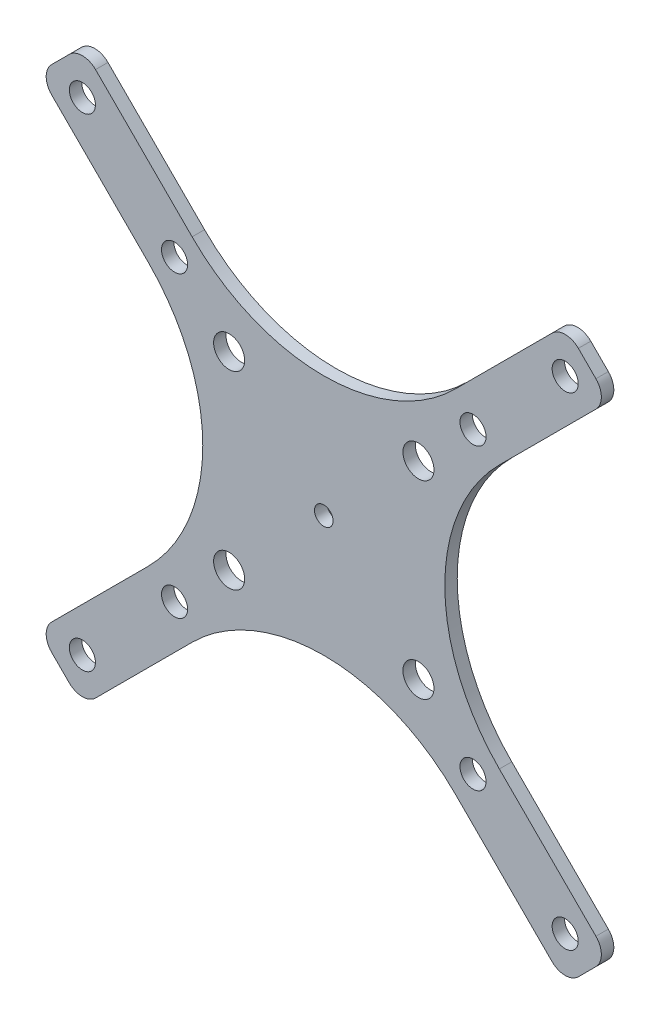
from build123d import *

# Parameters (mm, degrees)
CROQUIS1_R              = 2.5
CROQUIS1_R_2            = 2.1
CROQUIS1_R_3            = 1.5
SALIENTE_EXTRUIR1_DEPTH = 2
REDONDEO3_R             = 3


with BuildPart() as part:
    # Croquis1 → Saliente-Extruir1 (new body)
    with BuildSketch(Plane.XY):
        with BuildLine():
            Line((-31.096194078, 38.16726189), (-21.213203436, 28.284271247))
            ThreePointArc((-21.213203436, 28.284271247), (0, 19.497474683), (21.213203436, 28.284271247))
            Line((21.213203436, 28.284271247), (31.096194078, 38.16726189))
            Line((31.096194078, 38.16726189), (38.890872965, 45.961940777))
            Line((38.890872965, 45.961940777), (42.426406871, 42.426406871))
            Line((42.426406871, 42.426406871), (45.961940777, 38.890872965))
            Line((45.961940777, 38.890872965), (38.16726189, 31.096194078))
            Line((38.16726189, 31.096194078), (28.284271247, 21.213203436))
            ThreePointArc((28.284271247, 21.213203436), (19.497474683, 0), (28.284271247, -21.213203436))
            Line((28.284271247, -21.213203436), (38.16726189, -31.096194078))
            Line((38.16726189, -31.096194078), (45.961940777, -38.890872965))
            Line((45.961940777, -38.890872965), (42.426406871, -42.426406871))
            Line((42.426406871, -42.426406871), (38.890872965, -45.961940777))
            Line((38.890872965, -45.961940777), (31.096194078, -38.16726189))
            Line((31.096194078, -38.16726189), (21.213203436, -28.284271247))
            ThreePointArc((21.213203436, -28.284271247), (0, -19.497474683), (-21.213203436, -28.284271247))
            Line((-21.213203436, -28.284271247), (-31.096194078, -38.16726189))
            Line((-31.096194078, -38.16726189), (-38.890872965, -45.961940777))
            Line((-38.890872965, -45.961940777), (-42.426406871, -42.426406871))
            Line((-42.426406871, -42.426406871), (-45.961940777, -38.890872965))
            Line((-45.961940777, -38.890872965), (-38.16726189, -31.096194078))
            Line((-38.16726189, -31.096194078), (-28.284271247, -21.213203436))
            ThreePointArc((-28.284271247, -21.213203436), (-19.497474683, 0), (-28.284271247, 21.213203436))
            Line((-28.284271247, 21.213203436), (-38.16726189, 31.096194078))
            Line((-38.16726189, 31.096194078), (-45.961940777, 38.890872965))
            Line((-45.961940777, 38.890872965), (-42.426406871, 42.426406871))
            Line((-42.426406871, 42.426406871), (-38.890872965, 45.961940777))
            Line((-38.890872965, 45.961940777), (-31.096194078, 38.16726189))
        make_face()
        with Locations((-15.25, 15.25)):
            Circle(CROQUIS1_R, mode=Mode.SUBTRACT)
        with Locations((-24.04163056, 24.04163056)):
            Circle(CROQUIS1_R_2, mode=Mode.SUBTRACT)
        with Locations((-38.890872965, 38.890872965)):
            Circle(CROQUIS1_R_2, mode=Mode.SUBTRACT)
        with Locations(Location((38.890872965, 38.890872965, 0), (0, 0, 180))):
            Circle(CROQUIS1_R_2, mode=Mode.SUBTRACT)
        with Locations(Location((24.04163056, 24.04163056, 0), (0, 0, 180))):
            Circle(CROQUIS1_R_2, mode=Mode.SUBTRACT)
        with Locations(Location((15.25, 15.25, 0), (0, 0, 180))):
            Circle(CROQUIS1_R, mode=Mode.SUBTRACT)
        with Locations((15.25, -15.25)):
            Circle(CROQUIS1_R, mode=Mode.SUBTRACT)
        with Locations((24.04163056, -24.04163056)):
            Circle(CROQUIS1_R_2, mode=Mode.SUBTRACT)
        with Locations((38.890872965, -38.890872965)):
            Circle(CROQUIS1_R_2, mode=Mode.SUBTRACT)
        with Locations(Location((-15.25, -15.25, 0), (0, 0, 180))):
            Circle(CROQUIS1_R, mode=Mode.SUBTRACT)
        with Locations(Location((-24.04163056, -24.04163056, 0), (0, 0, 180))):
            Circle(CROQUIS1_R_2, mode=Mode.SUBTRACT)
        with Locations(Location((-38.890872965, -38.890872965, 0), (0, 0, 180))):
            Circle(CROQUIS1_R_2, mode=Mode.SUBTRACT)
        Circle(CROQUIS1_R_3, mode=Mode.SUBTRACT)
    extrude(amount=SALIENTE_EXTRUIR1_DEPTH)

    # Redondeo3
    redondeo3_edges = [part.edges().sort_by_distance(p)[0] for p in [
        (-38.890872965, 45.961940777, 1),
        (38.890872965, 45.961940777, 1),
        (45.961940777, 38.890872965, 1),
        (45.961940777, -38.890872965, 1),
        (38.890872965, -45.961940777, 1),
        (-38.890872965, -45.961940777, 1),
        (-45.961940777, -38.890872965, 1),
        (-45.961940777, 38.890872965, 1),
    ]]
    fillet(redondeo3_edges, radius=REDONDEO3_R)


solid = part.part
